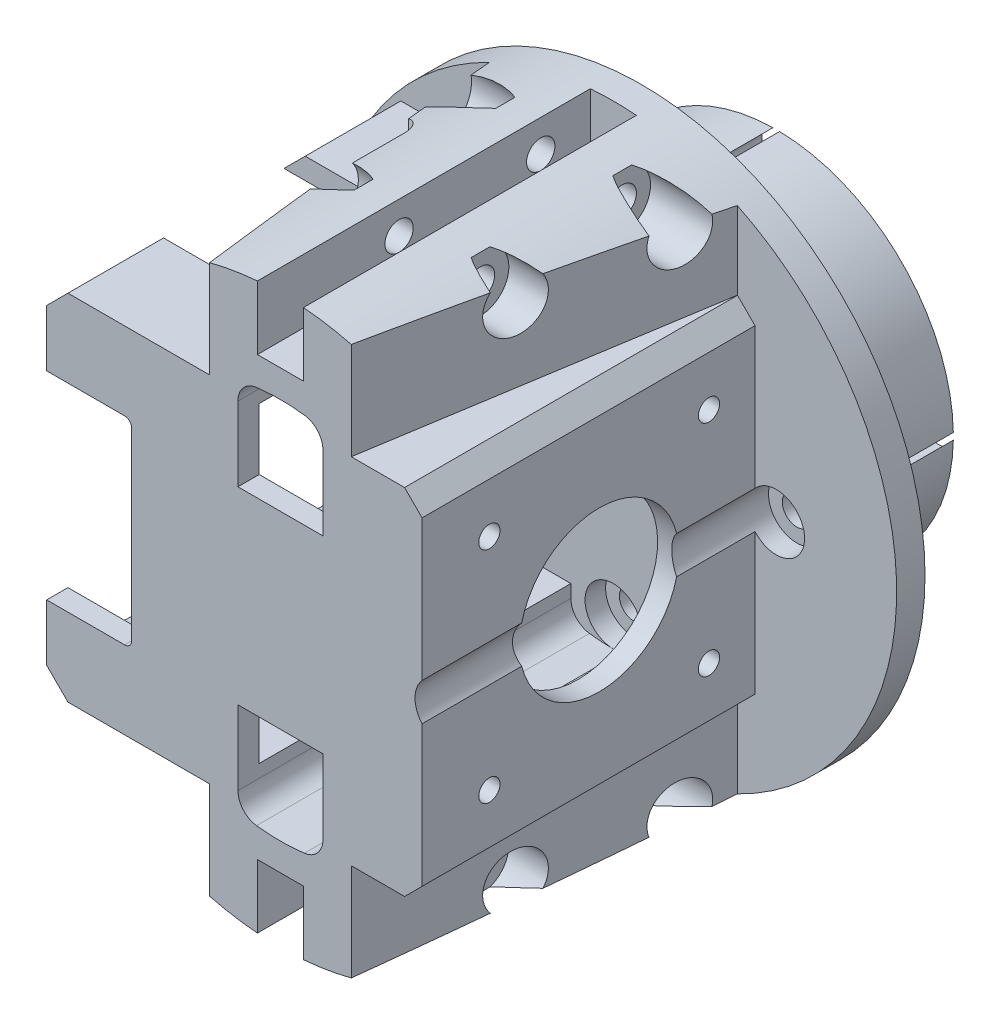
from build123d import *
from build123d.topology import SkipClean

# Parameters (mm, degrees)
SKETCH_1_R                = 25
EXTRUDE_1_DEPTH           = 13
SKETCH_3_R                = 40
EXTRUDE_3_DEPTH           = 4
EXTRUDE_4_DEPTH           = 44
EXTRUDE_5_DEPTH           = 3
EXTRUDE_6_DEPTH           = 15
EXTRUDE_START             = -65
EXTRUDE_7_DEPTH           = 15
CUT_EXTRUDE_START         = -47
CUT_EXTRUDE_7_DEPTH       = 47
CUT_EXTRUDE_8_REACH       = 107
SKETCH_15_R               = 2
SKETCH_17_R               = 4
CUT_EXTRUDE_9_DEPTH       = 24.75
CUT_EXTRUDE_START_2       = -11.75
SKETCH_18_R               = 4
CUT_EXTRUDE_10_DEPTH      = 11.75
SKETCH_19_R               = 1.5
SKETCH_19_R_2             = 11.25
CUT_EXTRUDE_11_DEPTH      = 3
CUT_EXTRUDE_15_REACH      = 87.417
SKETCH_21_R               = 4
FILLET_1_R                = 3
CUT_EXTRUDE_16_REACH      = 87.417
SKETCH_6_R                = 2.05
SKETCH_27_R               = 13.5
CUT_EXTRUDE_17_DEPTH      = 14
CUT_EXTRUDE_18_REACH      = 87.417
SKETCH_28_R               = 4
SKETCH_29_R               = 4
CUT_EXTRUDE_21_DEPTH      = 2.9
CUT_EXTRUDE_22_DEPTH      = 100.604216842
CUT_EXTRUDE_22_DEPTH_BACK = 100.604216842
SKETCH_30_W               = 20
SKETCH_30_H               = 20
FILLET_2_R                = 3
FILLET_3_R                = 1
EXTRUDE_START_2           = 3
SKETCH_31_R               = 28
SKETCH_31_R_2             = 25
EXTRUDE_8_DEPTH           = 3
EXTRUDE_START_3           = 6
SKETCH_32_R               = 13.5
EXTRUDE_9_DEPTH           = 6


with BuildPart() as part:
    # 草图1 → 凸台-拉伸1 (new body)
    with BuildSketch(Plane.XY):
        with Locations(Location((0, 0, 0), (0, 0, 180))):
            Circle(SKETCH_1_R)
    extrude(amount=EXTRUDE_1_DEPTH)

    # 草图3 → 凸台-拉伸3 (add)
    with BuildSketch(Plane.XY.offset(13)):
        Circle(SKETCH_3_R)
    extrude(amount=EXTRUDE_3_DEPTH)

    # 草图4 → 凸台-拉伸4 (add)
    with BuildSketch(Plane.XY.offset(17)):
        Polygon((-33, 22), (-30, 25), (17.525126266, 25), (20, 22.525126266), (20, -22.525126266), (17.525126266, -25), (-30, -25), (-33, -22), (17, -22), (17, 22), align=None)
    extrude(amount=EXTRUDE_4_DEPTH)

    # 草图5 → 凸台-拉伸5 (add)
    with BuildSketch(Plane.XY.offset(61)):
        Polygon((-33, 22), (-33, 14), (-21, 14), (-21, -14), (-33, -14), (-33, -22), (-30, -25), (17.525126266, -25), (20, -22.525126266), (20, 22.525126266), (17.525126266, 25), (-30, 25), align=None)
    extrude(amount=EXTRUDE_5_DEPTH)

    # 草图8 → 凸台-拉伸6 (add)
    with BuildSketch(Plane(origin=(0, 25, 0), x_dir=(1, 0, 0), z_dir=(0, 1, 0))):
        Polygon((-3.25, -17), (3.25, -17), (17.5, -17), (10, -64), (3.25, -64), (-3.25, -64), (-10, -64), (-17.5, -17), align=None)
    extrude(amount=EXTRUDE_6_DEPTH)

    # 草图9 → 凸台-拉伸7 (add)
    with BuildSketch(Plane(origin=(0, 40, 0), x_dir=(1, 0, 0), z_dir=(0, 1, 0)).offset(EXTRUDE_START)):
        Polygon((10, -64), (17.5, -17), (0, -17), (-17.5, -17), (-10, -64), align=None)
    extrude(amount=-EXTRUDE_7_DEPTH)

    # 草图10 → 切除-拉伸7 (cut)
    with BuildSketch(Plane.XY.offset(64).offset(CUT_EXTRUDE_START)):
        with BuildLine():
            Line((-3.25, -30.867750125), (3.25, -30.867750125))
            Line((3.25, -30.867750125), (3.25, -39.867750125))
            ThreePointArc((3.25, -39.867750125), (10.556571506, -38.581845446), (17.5, -35.968736425))
            Line((17.5, -35.968736425), (17.5, -40))
            Line((17.5, -40), (-17.5, -40))
            Line((-17.5, -40), (-17.5, -35.968736425))
            ThreePointArc((-17.5, -35.968736425), (-10.556571506, -38.581845446), (-3.25, -39.867750125))
            Line((-3.25, -39.867750125), (-3.25, -30.867750125))
        make_face()
        with BuildLine():
            Line((17.5, 35.968736425), (17.5, 40))
            Line((17.5, 40), (-17.5, 40))
            Line((-17.5, 40), (-17.5, 35.968736425))
            ThreePointArc((-17.5, 35.968736425), (-10.556571506, 38.581845446), (-3.25, 39.867750125))
            Line((-3.25, 39.867750125), (-3.25, 30.867750125))
            Line((-3.25, 30.867750125), (3.25, 30.867750125))
            Line((3.25, 30.867750125), (3.25, 39.867750125))
            ThreePointArc((3.25, 39.867750125), (10.556571506, 38.581845446), (17.5, 35.968736425))
        make_face()
    extrude(amount=CUT_EXTRUDE_7_DEPTH, mode=Mode.SUBTRACT)

    # 切除-拉伸8: up to this face of the body (flat: up to its plane)
    cut_extrude_8_end = Plane(part.part.faces().sort_by_distance((20, 0, 40.5))[0])
    # 草图15 → 切除-拉伸8 (cut, up to the picked face)
    with BuildSketch(Plane.ZY.offset(33), mode=Mode.PRIVATE) as cut_extrude_8_sk1:
        with Locations(Location((24, -35.367750125, 0), (0, 0, 321.866663973))):
            Circle(SKETCH_15_R)
    cut_extrude_8_tool1 = split(extrude(cut_extrude_8_sk1.sketch, amount=-CUT_EXTRUDE_8_REACH, mode=Mode.PRIVATE), bisect_by=cut_extrude_8_end, keep=Keep.BOTH, mode=Mode.PRIVATE)
    # 草图15 → 切除-拉伸8 (cut, up to the picked face)
    with BuildSketch(Plane.ZY.offset(33), mode=Mode.PRIVATE) as cut_extrude_8_sk2:
        with Locations((44, -35.367750125)):
            Circle(SKETCH_15_R)
    cut_extrude_8_tool2 = split(extrude(cut_extrude_8_sk2.sketch, amount=-CUT_EXTRUDE_8_REACH, mode=Mode.PRIVATE), bisect_by=cut_extrude_8_end, keep=Keep.BOTH, mode=Mode.PRIVATE)
    # 草图15 → 切除-拉伸8 (cut, up to the picked face)
    with BuildSketch(Plane.ZY.offset(33), mode=Mode.PRIVATE) as cut_extrude_8_sk3:
        with Locations(Location((44, 35.367750125, 0), (0, 0, 270))):
            Circle(SKETCH_15_R)
    cut_extrude_8_tool3 = split(extrude(cut_extrude_8_sk3.sketch, amount=-CUT_EXTRUDE_8_REACH, mode=Mode.PRIVATE), bisect_by=cut_extrude_8_end, keep=Keep.BOTH, mode=Mode.PRIVATE)
    # 草图15 → 切除-拉伸8 (cut, up to the picked face)
    with BuildSketch(Plane.ZY.offset(33), mode=Mode.PRIVATE) as cut_extrude_8_sk4:
        with Locations(Location((24, 35.367750125, 0), (0, 0, 270))):
            Circle(SKETCH_15_R)
    cut_extrude_8_tool4 = split(extrude(cut_extrude_8_sk4.sketch, amount=-CUT_EXTRUDE_8_REACH, mode=Mode.PRIVATE), bisect_by=cut_extrude_8_end, keep=Keep.BOTH, mode=Mode.PRIVATE)
    add(cut_extrude_8_tool1.solids().sort_by(Axis((-33, -35.36775, 24), (1, 0, 0)))[0], mode=Mode.SUBTRACT)
    add(cut_extrude_8_tool2.solids().sort_by(Axis((-33, -35.36775, 44), (1, 0, 0)))[0], mode=Mode.SUBTRACT)
    add(cut_extrude_8_tool3.solids().sort_by(Axis((-33, 35.36775, 44), (1, 0, 0)))[0], mode=Mode.SUBTRACT)
    add(cut_extrude_8_tool4.solids().sort_by(Axis((-33, 35.36775, 24), (1, 0, 0)))[0], mode=Mode.SUBTRACT)

    # 草图17 → 切除-拉伸9 (cut)
    with SkipClean():  # the faces are left unmerged after this step: merging them gives an invalid solid
        with BuildSketch(Plane.ZY.offset(33)):
            with Locations((44, -35.367750125)):
                Circle(SKETCH_17_R)
            with Locations((24, -35.367750125)):
                Circle(SKETCH_17_R)
            with Locations((24, 35.367750125)):
                Circle(SKETCH_17_R)
            with Locations((44, 35.367750125)):
                Circle(SKETCH_17_R)
        extrude(amount=-CUT_EXTRUDE_9_DEPTH, mode=Mode.SUBTRACT)

    # 草图18 → 切除-拉伸10 (cut)
    with SkipClean():  # the faces are left unmerged after this step: merging them gives an invalid solid
        with BuildSketch(Plane(origin=(20, 0, 0), x_dir=(0, 0, -1), z_dir=(1, 0, 0)).offset(CUT_EXTRUDE_START_2)):
            with Locations((-44, 35.367750125)):
                Circle(SKETCH_18_R)
            with Locations((-24, 35.367750125)):
                Circle(SKETCH_18_R)
            with Locations((-44, -35.367750125)):
                Circle(SKETCH_18_R)
            with Locations((-24, -35.367750125)):
                Circle(SKETCH_18_R)
        extrude(amount=CUT_EXTRUDE_10_DEPTH, mode=Mode.SUBTRACT)

    # 草图19 → 切除-拉伸11 (cut)
    with SkipClean():  # the faces are left unmerged after this step: merging them gives an invalid solid
        with BuildSketch(Plane.ZY.offset(-17)):
            with Locations(Location((54.5, 15.5, 0), (0, 0, 270))):
                Circle(SKETCH_19_R)
            with Locations(Location((23.5, 15.5, 0), (0, 0, 270))):
                Circle(SKETCH_19_R)
            with Locations(Location((23.5, -15.5, 0), (0, 0, 270))):
                Circle(SKETCH_19_R)
            with Locations(Location((54.5, -15.5, 0), (0, 0, 270))):
                Circle(SKETCH_19_R)
            with Locations(Location((39, 0, 0), (0, 0, 270))):
                Circle(SKETCH_19_R_2)
        extrude(amount=-CUT_EXTRUDE_11_DEPTH, mode=Mode.SUBTRACT)

    # 切除-拉伸15: up to this face of the body (flat: up to its plane)
    cut_extrude_15_end = Plane(part.part.faces().sort_by_distance((-11.314587215, 0, 17))[0])
    # 草图21 → 切除-拉伸15 (cut, up to the picked face)
    with BuildSketch(Plane.XY.offset(64), mode=Mode.PRIVATE) as cut_extrude_15_sk1:
        with Locations((24, 0)):
            Circle(SKETCH_21_R)
    cut_extrude_15_tool1 = split(extrude(cut_extrude_15_sk1.sketch, amount=-CUT_EXTRUDE_15_REACH, mode=Mode.PRIVATE), bisect_by=cut_extrude_15_end, keep=Keep.BOTH, mode=Mode.PRIVATE)
    # 草图21 → 切除-拉伸15 (cut, up to the picked face)
    with BuildSketch(Plane.XY.offset(64), mode=Mode.PRIVATE) as cut_extrude_15_sk2:
        with BuildLine():
            Line((-6, -13.324893162), (6, -13.324893162))
            Line((6, -13.324893162), (6, -18.324893162))
            Line((6, -18.324893162), (6, -26.324893162))
            ThreePointArc((6, -26.324893162), (0, -27), (-6, -26.324893162))
            Line((-6, -26.324893162), (-6, -18.324893162))
            Line((-6, -18.324893162), (-6, -13.324893162))
        make_face()
    cut_extrude_15_tool2 = split(extrude(cut_extrude_15_sk2.sketch, amount=-CUT_EXTRUDE_15_REACH, mode=Mode.PRIVATE), bisect_by=cut_extrude_15_end, keep=Keep.BOTH, mode=Mode.PRIVATE)
    # 草图21 → 切除-拉伸15 (cut, up to the picked face)
    with BuildSketch(Plane.XY.offset(64), mode=Mode.PRIVATE) as cut_extrude_15_sk3:
        with BuildLine():
            Line((-6, 26.324893162), (-6, 18.324893162))
            Line((-6, 18.324893162), (-6, 13.324893162))
            Line((-6, 13.324893162), (6, 13.324893162))
            Line((6, 13.324893162), (6, 18.324893162))
            Line((6, 18.324893162), (6, 26.324893162))
            ThreePointArc((6, 26.324893162), (0, 27), (-6, 26.324893162))
        make_face()
    cut_extrude_15_tool3 = split(extrude(cut_extrude_15_sk3.sketch, amount=-CUT_EXTRUDE_15_REACH, mode=Mode.PRIVATE), bisect_by=cut_extrude_15_end, keep=Keep.BOTH, mode=Mode.PRIVATE)
    add(cut_extrude_15_tool1.solids().sort_by(Axis((24, 0, 64), (0, 0, -1)))[0], mode=Mode.SUBTRACT)
    add(cut_extrude_15_tool2.solids().sort_by(Axis((0, -20.051998, 64), (0, 0, -1)))[0], mode=Mode.SUBTRACT)
    add(cut_extrude_15_tool3.solids().sort_by(Axis((0, 20.051998, 64), (0, 0, -1)))[0], mode=Mode.SUBTRACT)

    # 圆角1
    fillet_1_edges = [part.edges().sort_by_distance(p)[0] for p in [
        (-6, -26.324893162, 40.5),
        (6, -26.324893162, 40.5),
        (6, 26.324893162, 40.5),
        (-6, 26.324893162, 40.5),
    ]]
    fillet(fillet_1_edges, radius=FILLET_1_R)

    # 切除-拉伸16: up to this face of the body (flat: up to its plane)
    cut_extrude_16_end = Plane(part.part.faces().sort_by_distance((24, 0, 17))[0])
    # 草图6 → 切除-拉伸16 (cut, up to the picked face)
    with BuildSketch(Plane(origin=(0, 0, 0), x_dir=(-1, 0, 0), z_dir=(0, 0, -1)), mode=Mode.PRIVATE) as cut_extrude_16_sk1:
        with Locations(Location((0, 23, 0), (0, 0, 76.770788383))):
            Circle(SKETCH_6_R)
    cut_extrude_16_tool1 = split(extrude(cut_extrude_16_sk1.sketch, amount=-CUT_EXTRUDE_16_REACH, mode=Mode.PRIVATE), bisect_by=cut_extrude_16_end, keep=Keep.BOTH, mode=Mode.PRIVATE)
    # 草图6 → 切除-拉伸16 (cut, up to the picked face)
    with BuildSketch(Plane(origin=(0, 0, 0), x_dir=(-1, 0, 0), z_dir=(0, 0, -1)), mode=Mode.PRIVATE) as cut_extrude_16_sk2:
        with Locations(Location((23, 0, 0), (0, 0, 346.770788383))):
            Circle(SKETCH_6_R)
    cut_extrude_16_tool2 = split(extrude(cut_extrude_16_sk2.sketch, amount=-CUT_EXTRUDE_16_REACH, mode=Mode.PRIVATE), bisect_by=cut_extrude_16_end, keep=Keep.BOTH, mode=Mode.PRIVATE)
    # 草图6 → 切除-拉伸16 (cut, up to the picked face)
    with BuildSketch(Plane(origin=(0, 0, 0), x_dir=(-1, 0, 0), z_dir=(0, 0, -1)), mode=Mode.PRIVATE) as cut_extrude_16_sk3:
        with Locations(Location((0, -23, 0), (0, 0, 283.229211617))):
            Circle(SKETCH_6_R)
    cut_extrude_16_tool3 = split(extrude(cut_extrude_16_sk3.sketch, amount=-CUT_EXTRUDE_16_REACH, mode=Mode.PRIVATE), bisect_by=cut_extrude_16_end, keep=Keep.BOTH, mode=Mode.PRIVATE)
    # 草图6 → 切除-拉伸16 (cut, up to the picked face)
    with BuildSketch(Plane(origin=(0, 0, 0), x_dir=(-1, 0, 0), z_dir=(0, 0, -1)), mode=Mode.PRIVATE) as cut_extrude_16_sk4:
        with Locations(Location((-23, 0, 0), (0, 0, 193.229211617))):
            Circle(SKETCH_6_R)
    cut_extrude_16_tool4 = split(extrude(cut_extrude_16_sk4.sketch, amount=-CUT_EXTRUDE_16_REACH, mode=Mode.PRIVATE), bisect_by=cut_extrude_16_end, keep=Keep.BOTH, mode=Mode.PRIVATE)
    add(cut_extrude_16_tool1.solids().sort_by(Axis((0, 23, 0), (0, 0, 1)))[0], mode=Mode.SUBTRACT)
    add(cut_extrude_16_tool2.solids().sort_by(Axis((-23, 0, 0), (0, 0, 1)))[0], mode=Mode.SUBTRACT)
    add(cut_extrude_16_tool3.solids().sort_by(Axis((0, -23, 0), (0, 0, 1)))[0], mode=Mode.SUBTRACT)
    add(cut_extrude_16_tool4.solids().sort_by(Axis((23, 0, 0), (0, 0, 1)))[0], mode=Mode.SUBTRACT)

    # 草图27 → 切除-拉伸17 (cut)
    with BuildSketch(Plane(origin=(0, 0, 0), x_dir=(-1, 0, 0), z_dir=(0, 0, -1))):
        Circle(SKETCH_27_R)
    extrude(amount=-CUT_EXTRUDE_17_DEPTH, mode=Mode.SUBTRACT)

    # 切除-拉伸18: up to this face of the body (flat: up to its plane)
    cut_extrude_18_end = Plane(part.part.faces().sort_by_distance((27.886862915, 0, 17))[0])
    # 草图28 → 切除-拉伸18 (cut, up to the picked face)
    with BuildSketch(Plane.XY.offset(64), mode=Mode.PRIVATE) as cut_extrude_18_sk1:
        with Locations((23, 0)):
            Circle(SKETCH_28_R)
    cut_extrude_18_tool1 = split(extrude(cut_extrude_18_sk1.sketch, amount=-CUT_EXTRUDE_18_REACH, mode=Mode.PRIVATE), bisect_by=cut_extrude_18_end, keep=Keep.BOTH, mode=Mode.PRIVATE)
    add(cut_extrude_18_tool1.solids().sort_by(Axis((23, 0, 64), (0, 0, -1)))[0], mode=Mode.SUBTRACT)

    # 草图29 → 切除-拉伸21 (cut)
    with SkipClean():  # the faces are left unmerged after this step: merging them gives an invalid solid
        with BuildSketch(Plane.XY.offset(17)):
            with Locations((23, 0)):
                Circle(SKETCH_29_R)
            with Locations((0, -23)):
                Circle(SKETCH_29_R)
            with Locations((-23, 0)):
                Circle(SKETCH_29_R)
            with Locations((0, 23)):
                Circle(SKETCH_29_R)
        extrude(amount=-CUT_EXTRUDE_21_DEPTH, mode=Mode.SUBTRACT)

    # 草图30 → 切除-拉伸22 (cut, two sides: drawn at the far end of the back side and taken through both)
    with SkipClean():  # the faces are left unmerged after this step: merging them gives an invalid solid
        with BuildSketch(Plane.XZ.offset(25).offset(-CUT_EXTRUDE_22_DEPTH_BACK)):
            with Locations((-23, 40.5)):
                Rectangle(SKETCH_30_W, SKETCH_30_H)
        extrude(amount=CUT_EXTRUDE_22_DEPTH + CUT_EXTRUDE_22_DEPTH_BACK, mode=Mode.SUBTRACT)

    # 圆角2
    fillet_2_edges = [part.edges().sort_by_distance(p)[0] for p in [
        (-13, -29.914280319, 30.5),
        (-13, 29.914280319, 30.5),
    ]]
    fillet(fillet_2_edges, radius=FILLET_2_R)

    # 圆角3
    fillet_3_edges = [part.edges().sort_by_distance(p)[0] for p in [
        (-21, 14, 62.5),
        (-21, -14, 62.5),
    ]]
    fillet(fillet_3_edges, radius=FILLET_3_R)

    # 草图31 → 凸台-拉伸8 (add)
    with BuildSketch(Plane(origin=(0, 0, 13), x_dir=(-1, 0, 0), z_dir=(0, 0, -1)).offset(EXTRUDE_START_2)):
        with Locations(Location((0, 0, 0), (0, 0, 180))):
            Circle(SKETCH_31_R)
        Circle(SKETCH_31_R_2, mode=Mode.SUBTRACT)
    extrude(amount=-EXTRUDE_8_DEPTH)

    # 草图32 → 凸台-拉伸9 (add)
    with BuildSketch(Plane(origin=(0, 0, 0), x_dir=(-1, 0, 0), z_dir=(0, 0, -1)).offset(EXTRUDE_START_3)):
        with BuildLine():
            ThreePointArc((24.995597826, 0.469136778), (17.67766953, 17.67766953), (0.469136778, 24.995597826))
            ThreePointArc((0.469136778, 24.995597826), (0, 20.95), (-0.469136778, 24.995597826))
            ThreePointArc((-0.469136778, 24.995597826), (-17.67766953, 17.67766953), (-24.995597826, 0.469136778))
            ThreePointArc((-24.995597826, 0.469136778), (-20.95, 0), (-24.995597826, -0.469136778))
            ThreePointArc((-24.995597826, -0.469136778), (-17.67766953, -17.67766953), (-0.469136778, -24.995597826))
            ThreePointArc((-0.469136778, -24.995597826), (0, -20.95), (0.469136778, -24.995597826))
            ThreePointArc((0.469136778, -24.995597826), (17.67766953, -17.67766953), (24.995597826, -0.469136778))
            ThreePointArc((24.995597826, -0.469136778), (20.95, 0), (24.995597826, 0.469136778))
        make_face()
        Circle(SKETCH_32_R, mode=Mode.SUBTRACT)
    extrude(amount=-EXTRUDE_9_DEPTH)


solid = part.part
